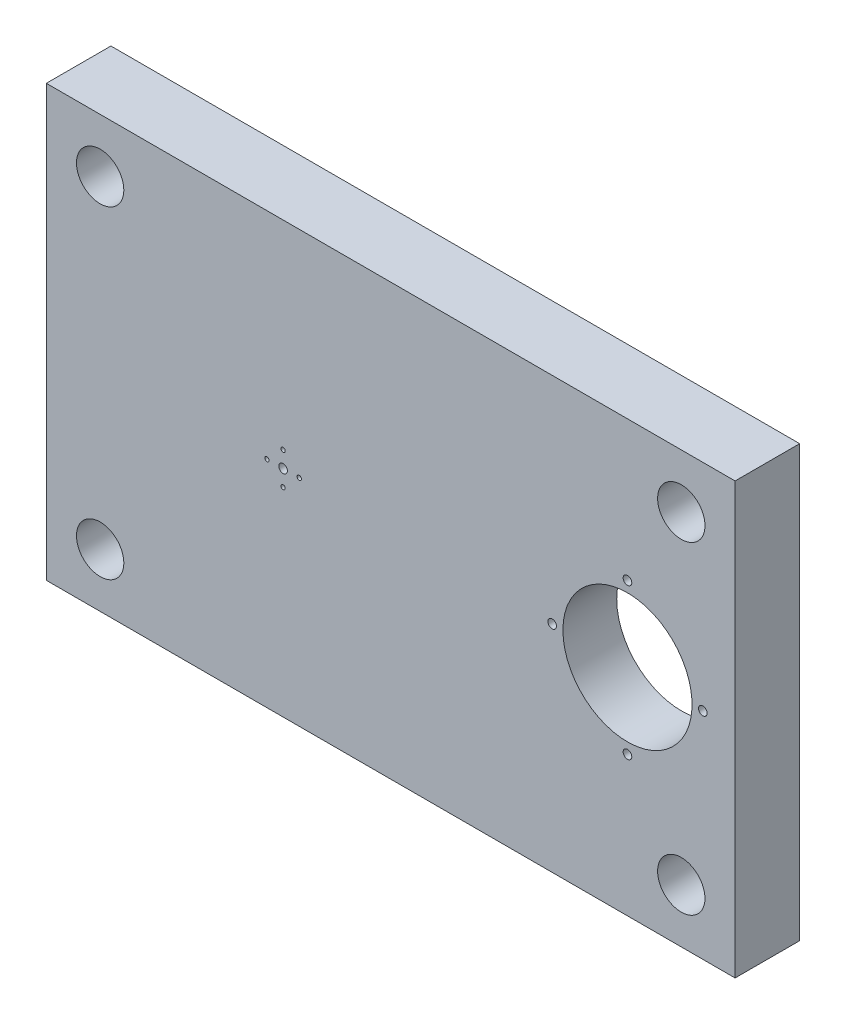
from build123d import *

# Parameters (mm, degrees)
SKETCH1_W           = 320
SKETCH1_H           = 200
SKETCH1_R           = 8.1
BOSS_EXTRUDE1_DEPTH = 30
SKETCH2_R           = 11
CUT_EXTRUDE1_DEPTH  = 20
SKETCH3_R           = 58.5
CUT_EXTRUDE2_DEPTH  = 5
CUT_EXTRUDE3_DEPTH  = 20
SKETCH5_R           = 2
CUT_EXTRUDE4_DEPTH  = 379.186461947
SKETCH6_R           = 40
CUT_EXTRUDE5_DEPTH  = 5
SKETCH7_R           = 30
CUT_EXTRUDE6_DEPTH  = 379.549864615
SKETCH8_R           = 2
CUT_EXTRUDE7_DEPTH  = 379.549864615
SKETCH9_R           = 1
CUT_EXTRUDE8_DEPTH  = 379.549864615


with BuildPart() as part:
    # Sketch1 → Boss-Extrude1 (new body)
    with BuildSketch(Plane.XY):
        with Locations((160, 100)):
            Rectangle(SKETCH1_W, SKETCH1_H)
        with Locations((25, 175)):
            Circle(SKETCH1_R, mode=Mode.SUBTRACT)
        with Locations((295, 175)):
            Circle(SKETCH1_R, mode=Mode.SUBTRACT)
        with Locations((25, 25)):
            Circle(SKETCH1_R, mode=Mode.SUBTRACT)
        with Locations((295, 25)):
            Circle(SKETCH1_R, mode=Mode.SUBTRACT)
    extrude(amount=BOSS_EXTRUDE1_DEPTH)

    # Sketch2 → Cut-Extrude1 (cut)
    with BuildSketch(Plane.XY.offset(30)):
        with Locations((295, 175)):
            Circle(SKETCH2_R)
        with Locations((25, 175)):
            Circle(SKETCH2_R)
        with Locations((25, 25)):
            Circle(SKETCH2_R)
        with Locations((295, 25)):
            Circle(SKETCH2_R)
    extrude(amount=-CUT_EXTRUDE1_DEPTH, mode=Mode.SUBTRACT)

    # Sketch3 → Cut-Extrude2 (cut)
    with BuildSketch(Plane(origin=(0, 0, 0), x_dir=(-1, 0, 0), z_dir=(0, 0, -1))):
        with Locations((-110, 100)):
            Circle(SKETCH3_R)
    extrude(amount=-CUT_EXTRUDE2_DEPTH, mode=Mode.SUBTRACT)

    # Sketch4 → Cut-Extrude3 (cut)
    with BuildSketch(Plane(origin=(0, 0, 5), x_dir=(-1, 0, 0), z_dir=(0, 0, -1))):
        with BuildLine():
            Line((-110, 116), (11.374075995, 116))
            Line((11.374075995, 116), (11.374075995, 84))
            Line((11.374075995, 84), (-110, 84))
            ThreePointArc((-110, 84), (-126, 100), (-110, 116))
        make_face()
    extrude(amount=-CUT_EXTRUDE3_DEPTH, mode=Mode.SUBTRACT)

    # Sketch5 → Cut-Extrude4 (cut, through all)
    with BuildSketch(Plane(origin=(0, 0, 25), x_dir=(-1, 0, 0), z_dir=(0, 0, -1))):
        with Locations((-110, 100)):
            Circle(SKETCH5_R)
    extrude(amount=-CUT_EXTRUDE4_DEPTH, mode=Mode.SUBTRACT)

    # Sketch6 → Cut-Extrude5 (cut)
    with BuildSketch(Plane(origin=(0, 0, 0), x_dir=(-1, 0, 0), z_dir=(0, 0, -1))):
        with Locations((-270, 100)):
            Circle(SKETCH6_R)
    extrude(amount=-CUT_EXTRUDE5_DEPTH, mode=Mode.SUBTRACT)

    # Sketch7 → Cut-Extrude6 (cut, through all)
    with BuildSketch(Plane(origin=(0, 0, 0), x_dir=(-1, 0, 0), z_dir=(0, 0, -1))):
        with Locations((-270, 100)):
            Circle(SKETCH7_R)
    extrude(amount=-CUT_EXTRUDE6_DEPTH, mode=Mode.SUBTRACT)

    # Sketch8 → Cut-Extrude7 (cut, through all)
    with BuildSketch(Plane(origin=(0, 0, 0), x_dir=(-1, 0, 0), z_dir=(0, 0, -1))):
        with Locations((-270, 135)):
            Circle(SKETCH8_R)
        with Locations((-235, 100)):
            Circle(SKETCH8_R)
        with Locations((-270, 65)):
            Circle(SKETCH8_R)
        with Locations((-305, 100)):
            Circle(SKETCH8_R)
    extrude(amount=-CUT_EXTRUDE7_DEPTH, mode=Mode.SUBTRACT)

    # Sketch9 → Cut-Extrude8 (cut, through all)
    with BuildSketch(Plane.XY.offset(30)):
        with Locations((110, 107.5)):
            Circle(SKETCH9_R)
        with Locations((117.5, 100)):
            Circle(SKETCH9_R)
        with Locations((110, 92.5)):
            Circle(SKETCH9_R)
        with Locations((102.5, 100)):
            Circle(SKETCH9_R)
    extrude(amount=-CUT_EXTRUDE8_DEPTH, mode=Mode.SUBTRACT)


solid = part.part
